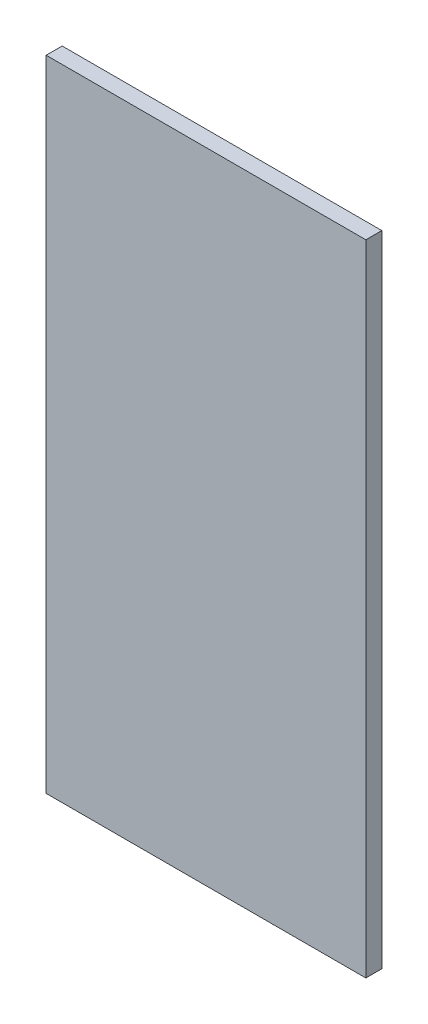
from build123d import *

# Parameters (mm, degrees)
SKETCH_1_W      = 100
SKETCH_1_H      = 200
EXTRUDE_1_DEPTH = 5


with BuildPart() as part:
    # 스케치1 → 보스-돌출1 (new body)
    with BuildSketch(Plane.XY):
        with Locations((50, 100)):
            Rectangle(SKETCH_1_W, SKETCH_1_H)
    extrude(amount=EXTRUDE_1_DEPTH)


solid = part.part
